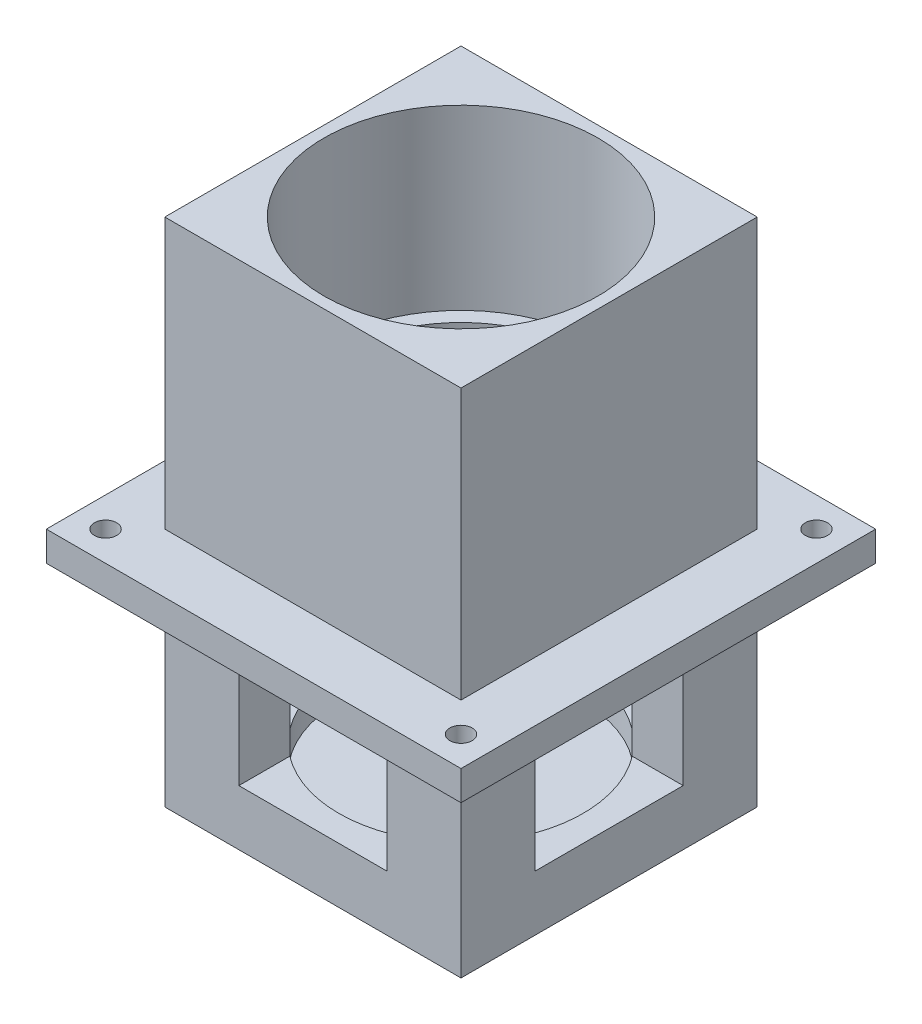
from build123d import *

# Parameters (mm, degrees)
SKETCH1_W           = 40
SKETCH1_H           = 40
BOSS_EXTRUDE1_DEPTH = 90
SKETCH2_R           = 18.5
CUT_EXTRUDE1_DEPTH  = 45
SKETCH3_R           = 16.5
CUT_EXTRUDE2_DEPTH  = 41
SKETCH4_W           = 40
SKETCH4_H           = 40
CUT_EXTRUDE3_DEPTH  = 21
SKETCH6_W           = 20
SKETCH6_H           = 15
CUT_EXTRUDE4_DEPTH  = 83.225300243
SKETCH8_W           = 20
SKETCH8_H           = 15
CUT_EXTRUDE5_DEPTH  = 83.225300243
SKETCH16_W          = 40
SKETCH16_H          = 4
BOSS_EXTRUDE3_DEPTH = 8
SKETCH17_W          = 40
SKETCH17_H          = 4
BOSS_EXTRUDE4_DEPTH = 8
SKETCH18_W          = 56
SKETCH18_H          = 4
BOSS_EXTRUDE5_DEPTH = 8
SKETCH19_W          = 56
SKETCH19_H          = 4
BOSS_EXTRUDE6_DEPTH = 8
SKETCH20_R          = 1.5
CUT_EXTRUDE9_DEPTH  = 54.853969213


with BuildPart() as part:
    # Sketch1 → Boss-Extrude1 (new body)
    with BuildSketch(Plane(origin=(0, 0, 0), x_dir=(1, 0, 0), z_dir=(0, 1, 0))):
        Rectangle(SKETCH1_W, SKETCH1_H)
    extrude(amount=BOSS_EXTRUDE1_DEPTH)

    # Sketch2 → Cut-Extrude1 (cut)
    with BuildSketch(Plane(origin=(0, 90, 0), x_dir=(1, 0, 0), z_dir=(0, 1, 0))):
        with Locations(Location((0, 0, 0), (0, 0, 270))):
            Circle(SKETCH2_R)
    extrude(amount=-CUT_EXTRUDE1_DEPTH, mode=Mode.SUBTRACT)

    # Sketch3 → Cut-Extrude2 (cut)
    with BuildSketch(Plane(origin=(0, 45, 0), x_dir=(1, 0, 0), z_dir=(0, 1, 0))):
        with Locations(Location((0, 0, 0), (0, 0, 270))):
            Circle(SKETCH3_R)
    extrude(amount=-CUT_EXTRUDE2_DEPTH, mode=Mode.SUBTRACT)

    # Sketch4 → Cut-Extrude3 (cut)
    with BuildSketch(Plane(origin=(0, 90, 0), x_dir=(1, 0, 0), z_dir=(0, 1, 0))):
        Rectangle(SKETCH4_W, SKETCH4_H)
    extrude(amount=-CUT_EXTRUDE3_DEPTH, mode=Mode.SUBTRACT)

    # Sketch6 → Cut-Extrude4 (cut, through all)
    with BuildSketch(Plane.XY.offset(20)):
        with Locations((0, 15)):
            Rectangle(SKETCH6_W, SKETCH6_H)
    extrude(amount=-CUT_EXTRUDE4_DEPTH, mode=Mode.SUBTRACT)

    # Sketch8 → Cut-Extrude5 (cut, through all)
    with BuildSketch(Plane.ZY.offset(20)):
        with Locations((0, 15)):
            Rectangle(SKETCH8_W, SKETCH8_H)
    extrude(amount=-CUT_EXTRUDE5_DEPTH, mode=Mode.SUBTRACT)

    # Sketch16 → Boss-Extrude3 (add)
    with BuildSketch(Plane.XY.offset(20)):
        with Locations((0, 30.5)):
            Rectangle(SKETCH16_W, SKETCH16_H)
    extrude(amount=BOSS_EXTRUDE3_DEPTH)

    # Sketch17 → Boss-Extrude4 (add)
    with BuildSketch(Plane(origin=(0, 0, -20), x_dir=(-1, 0, 0), z_dir=(0, 0, -1))):
        with Locations((0, 30.5)):
            Rectangle(SKETCH17_W, SKETCH17_H)
    extrude(amount=BOSS_EXTRUDE4_DEPTH)

    # Sketch18 → Boss-Extrude5 (add)
    with BuildSketch(Plane(origin=(20, 0, 0), x_dir=(0, 0, -1), z_dir=(1, 0, 0))):
        with Locations((0, 30.5)):
            Rectangle(SKETCH18_W, SKETCH18_H)
    extrude(amount=BOSS_EXTRUDE5_DEPTH)

    # Sketch19 → Boss-Extrude6 (add)
    with BuildSketch(Plane.ZY.offset(20)):
        with Locations((0, 30.5)):
            Rectangle(SKETCH19_W, SKETCH19_H)
    extrude(amount=BOSS_EXTRUDE6_DEPTH)

    # Sketch20 → Cut-Extrude9 (cut, through all)
    with BuildSketch(Plane(origin=(0, 32.5, 0), x_dir=(1, 0, 0), z_dir=(0, 1, 0))):
        with Locations(Location((-24, 24, 0), (0, 0, 270))):
            Circle(SKETCH20_R)
        with Locations(Location((24, 24, 0), (0, 0, 270))):
            Circle(SKETCH20_R)
        with Locations(Location((24, -24, 0), (0, 0, 270))):
            Circle(SKETCH20_R)
        with Locations(Location((-24, -24, 0), (0, 0, 270))):
            Circle(SKETCH20_R)
    extrude(amount=-CUT_EXTRUDE9_DEPTH, mode=Mode.SUBTRACT)


solid = part.part
